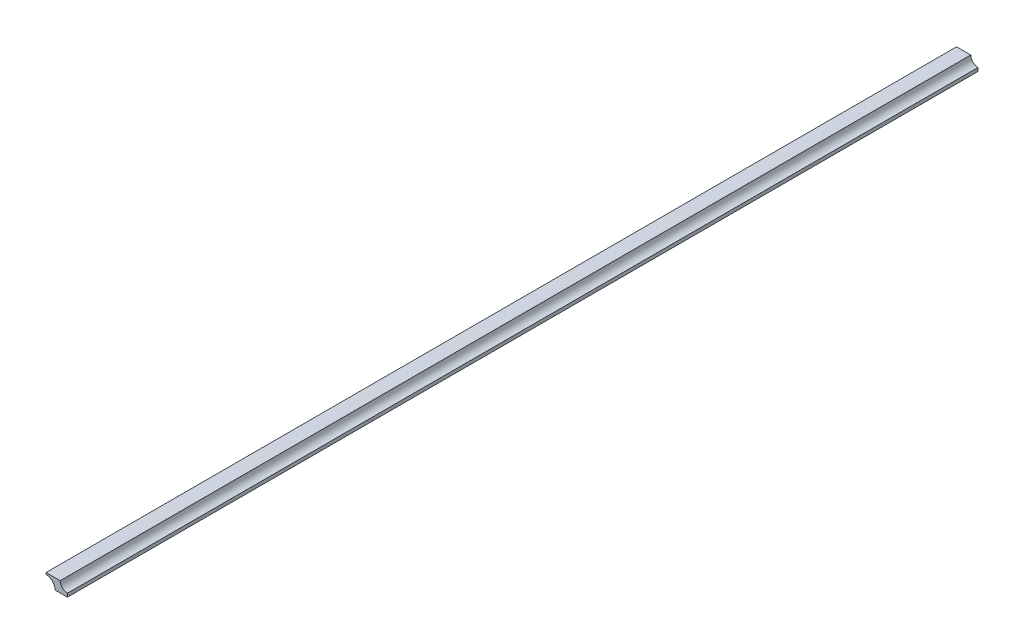
from build123d import *

# Parameters (mm, degrees)
BOSS_EXTRUDE1_DEPTH = 800


with BuildPart() as part:
    # Sketch1 → Boss-Extrude1 (new body)
    with BuildSketch(Plane.XY):
        with BuildLine():
            Line((7.94, 0), (18.8, 0))
            Line((18.8, 0), (18.8, 3.05))
            ThreePointArc((18.8, 3.05), (14.309871939, 4.909871939), (12.45, 9.4))
            Line((12.45, 9.4), (0, 9.4))
            Line((0, 9.4), (0, 7.94))
            ThreePointArc((0, 7.94), (5.614427843, 5.614427843), (7.94, 0))
        make_face()
    extrude(amount=BOSS_EXTRUDE1_DEPTH)


solid = part.part
